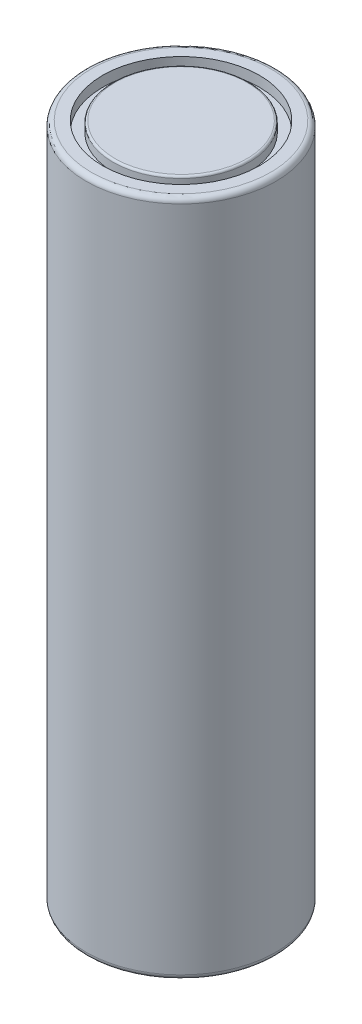
from build123d import *

# Parameters (mm, degrees)
SKETCH1_R           = 9.1
BOSS_EXTRUDE1_DEPTH = 65
SKETCH2_R           = 7.515816548
SKETCH2_R_2         = 6.528062022
CUT_EXTRUDE1_DEPTH  = 1
FILLET1_R           = 0.5
CUT_EXTRUDE2_START  = -1
SKETCH3_R           = 7.515816548
SKETCH3_R_2         = 6.528062022
CUT_EXTRUDE2_DEPTH  = 1
FILLET2_R           = 0.2


with BuildPart() as part:
    # Sketch1 → Boss-Extrude1 (new body)
    with BuildSketch(Plane(origin=(0, 0, 0), x_dir=(1, 0, 0), z_dir=(0, 1, 0))):
        with Locations(Location((0, 0, 0), (0, 0, 270))):
            Circle(SKETCH1_R)
    extrude(amount=BOSS_EXTRUDE1_DEPTH)

    # Sketch2 → Cut-Extrude1 (cut)
    with BuildSketch(Plane(origin=(0, 65, 0), x_dir=(1, 0, 0), z_dir=(0, 1, 0))):
        with Locations(Location((0, 0, 0), (0, 0, 270))):
            Circle(SKETCH2_R)
        with Locations(Location((0, 0, 0), (0, 0, 270))):
            Circle(SKETCH2_R_2, mode=Mode.SUBTRACT)
    extrude(amount=-CUT_EXTRUDE1_DEPTH, mode=Mode.SUBTRACT)

    # Fillet1
    fillet1_edges = [part.edges().sort_by_distance(p)[0] for p in [
        (0, 0, -9.1),
        (0, 65, -9.1),
    ]]
    fillet(fillet1_edges, radius=FILLET1_R)

    # Sketch3 → Cut-Extrude2 (cut)
    with BuildSketch(Plane.XZ.offset(CUT_EXTRUDE2_START)):
        with Locations(Location((0, 0, 0), (0, 0, 90))):
            Circle(SKETCH3_R)
        with Locations(Location((0, 0, 0), (0, 0, 90))):
            Circle(SKETCH3_R_2, mode=Mode.SUBTRACT)
    extrude(amount=CUT_EXTRUDE2_DEPTH, mode=Mode.SUBTRACT)

    # Fillet2
    fillet2_edges = [part.edges().sort_by_distance(p)[0] for p in [
        (0, 0, -6.528062022),
        (0, 65, -6.528062022),
    ]]
    fillet(fillet2_edges, radius=FILLET2_R)


solid = part.part
